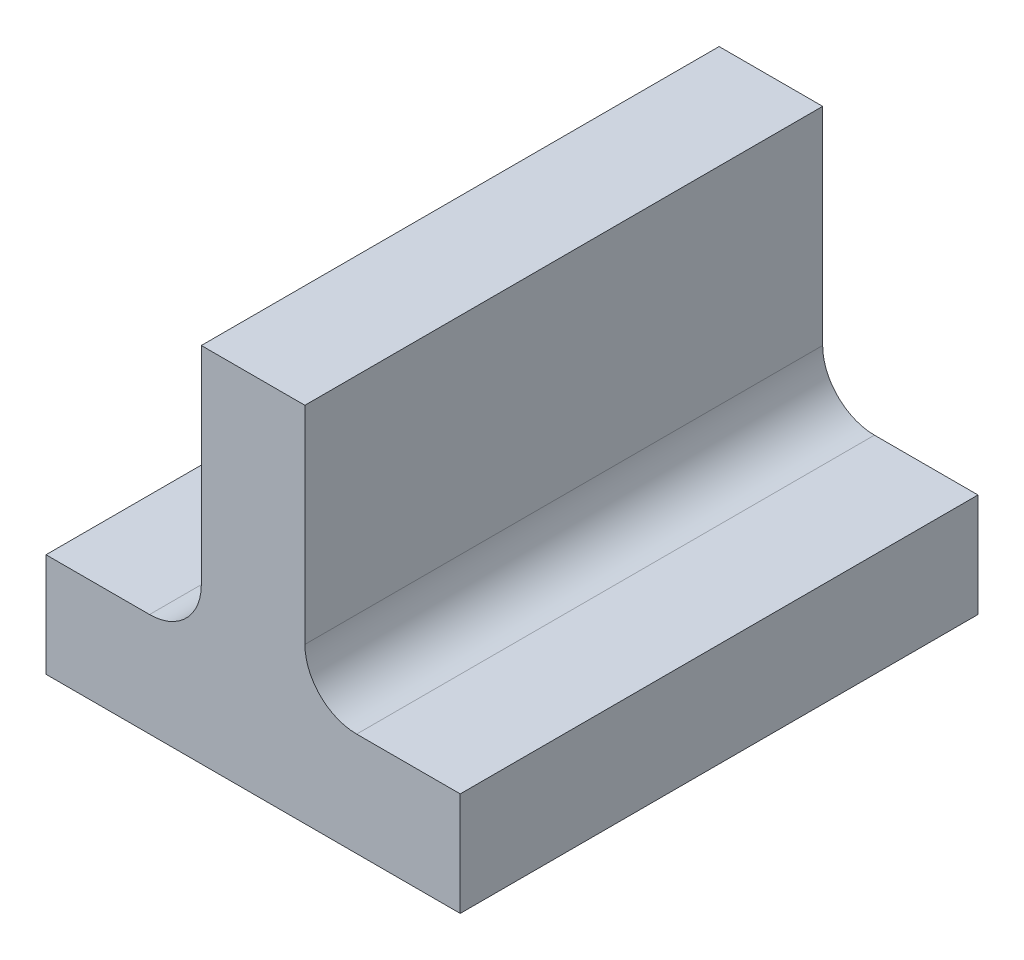
from build123d import *

# Parameters (mm, degrees)
BOSS_EXTRU_1_DEPTH = 20
CONG_1_R           = 2


with BuildPart() as part:
    # Esquisse1 → Boss.-Extru.1 (new body)
    with BuildSketch(Plane.XY):
        Polygon((-8, 0), (8, 0), (8, 4), (2, 4), (2, 14), (-2, 14), (-2, 4), (-8, 4), align=None)
    extrude(amount=BOSS_EXTRU_1_DEPTH)

    # Congé1
    cong_1_edges = [part.edges().sort_by_distance(p)[0] for p in [
        (-2, 4, 10),
        (2, 4, 10),
    ]]
    fillet(cong_1_edges, radius=CONG_1_R)


solid = part.part
